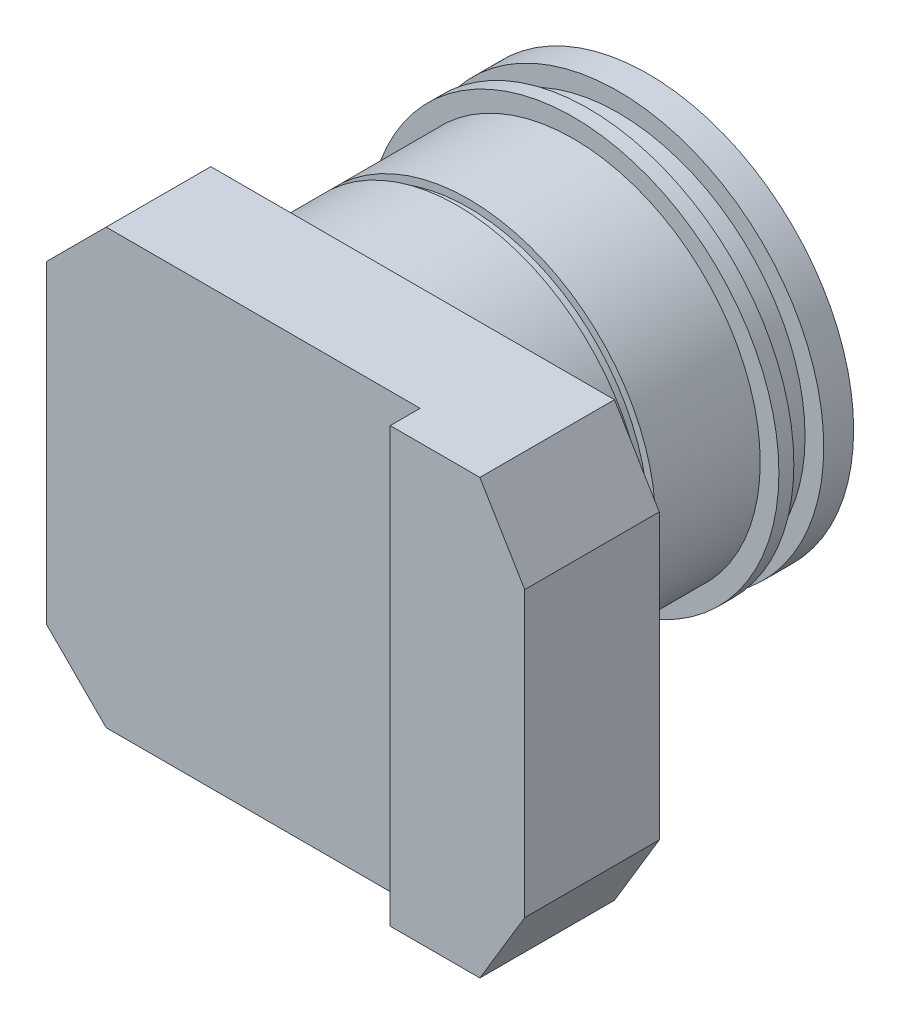
from build123d import *

# Parameters (mm, degrees)
SKETCH1_W           = 34
SKETCH1_H           = 29
BOSS_EXTRUDE1_DEPTH = 3.5
SKETCH2_W           = 9
SKETCH2_H           = 29
BOSS_EXTRUDE2_DEPTH = 2
CUT_EXTRUDE1_DEPTH  = 25.088378941
SKETCH5_R           = 9.75
CUT_EXTRUDE2_DEPTH  = 5
CUT_EXTRUDE2_DRAFT  = -45


with BuildPart() as part:
    # Sketch1 → Boss-Extrude1 (new, symmetric)
    with BuildSketch(Plane.XY):
        Rectangle(SKETCH1_W, SKETCH1_H)
    extrude(amount=BOSS_EXTRUDE1_DEPTH, both=True)

    # Sketch2 → Boss-Extrude2 (add)
    with BuildSketch(Plane.XY.offset(3.5)):
        with Locations((12.5, 0)):
            Rectangle(SKETCH2_W, SKETCH2_H)
    extrude(amount=BOSS_EXTRUDE2_DEPTH)

    # Sketch3 → Cut-Extrude1 (cut, through all)
    with BuildSketch(Plane(origin=(0, 0, -3.5), x_dir=(-1, 0, 0), z_dir=(0, 0, -1))):
        Polygon((-14, -14.5), (-17, -9.5), (-17, -14.5), align=None)
        Polygon((13, -14.5), (17, -10.5), (17, -14.5), align=None)
        Polygon((17, 10.5), (13, 14.5), (17, 14.5), align=None)
        Polygon((-17, 9.5), (-14, 14.5), (-17, 14.5), align=None)
    extrude(amount=-CUT_EXTRUDE1_DEPTH, mode=Mode.SUBTRACT)

    # Sketch4 → Revolve1 (revolve)
    with BuildSketch(Plane(origin=(0, 0, 0), x_dir=(1, 0, 0), z_dir=(0, 1, 0)), mode=Mode.PRIVATE) as revolve1_sk:
        Polygon((-17, 3.5), (-4.5, 3.5), (-4.5, 24.25), (-18.25, 24.25), (-18.25, 22.25), (-17, 22.25), (-17, 20.25), (-18.25, 20.25), (-18.25, 19.25), (-17, 19.25), (-17, 12.25), (-16.5, 12.25), (-16.5, 11.5), (-17, 11.5), align=None)
    revolve(revolve1_sk.sketch.rotate(Axis((-4.5, 0, -3.5), (0, 0, -1)), 180), axis=Axis((-4.5, 0, -3.5), (0, 0, -1)))


with BuildPart() as cut_extrude2_tool:
    # Sketch5 → Cut-Extrude2 (with draft: the straight prism first)
    with BuildSketch(Plane(origin=(0, 0, -24.25), x_dir=(-1, 0, 0), z_dir=(0, 0, -1))):
        with Locations((4.5, 0)):
            Circle(SKETCH5_R)
    extrude(amount=-CUT_EXTRUDE2_DEPTH)
    # Cut-Extrude2: the draft: its side faces are tilted about the plane it starts from
    cut_extrude2_sides = [cut_extrude2_tool.faces().sort_by_distance(p)[0] for p in [
        (5.25, 0, -21.75),
    ]]
    draft(cut_extrude2_sides, Plane(origin=(0, 0, -24.25), x_dir=(-1, 0, 0), z_dir=(0, 0, -1)), CUT_EXTRUDE2_DRAFT)


with BuildPart() as part_1:
    add(part.part)

    # Cut-Extrude2: cut by cut_extrude2_tool
    add(cut_extrude2_tool.part, mode=Mode.SUBTRACT)

    # Sketch6 → Revolve2 (revolve)
    with BuildSketch(Plane(origin=(0, 0, 0), x_dir=(1, 0, 0), z_dir=(0, 1, 0))):
        with BuildLine():
            Line((-9.25, 19.25), (-4.5, 19.25))
            Line((-4.5, 19.25), (-4.5, 24))
            ThreePointArc((-4.5, 24), (-7.858757211, 22.608757211), (-9.25, 19.25))
        make_face()
    revolve(axis=Axis((-4.5, 0, -19.25), (0, 0, -1)))


solid = part_1.part
